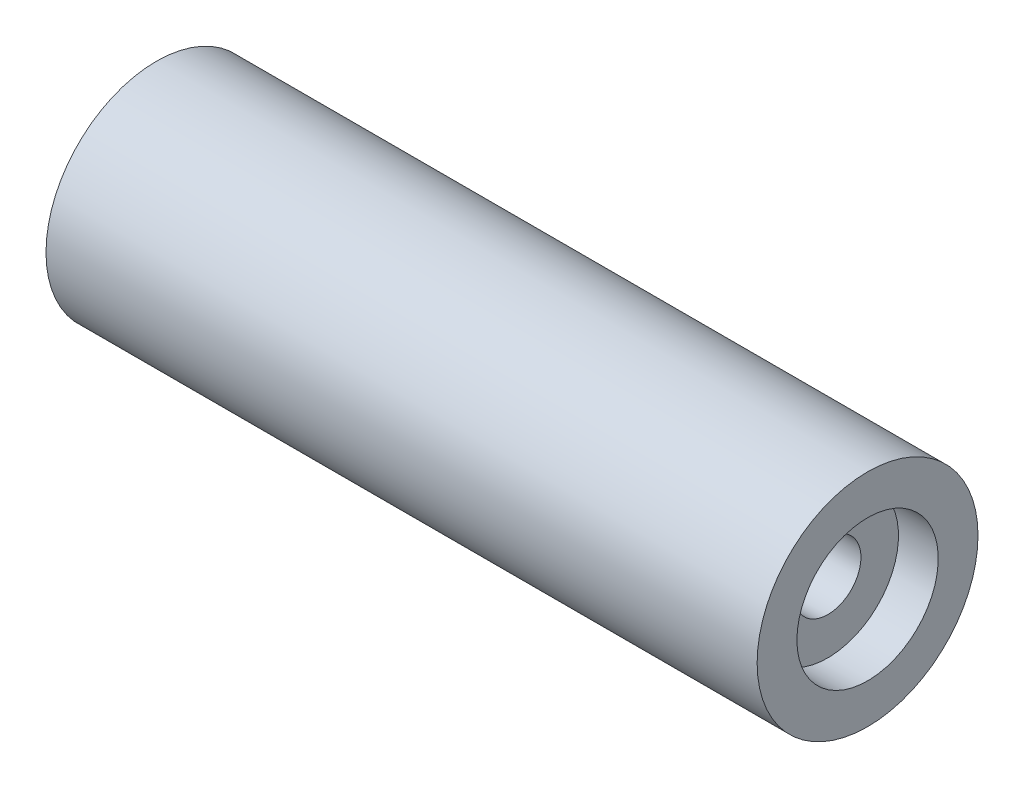
from build123d import *

# Parameters (mm, degrees)
SKETCH1_R           = 25
SKETCH1_R_2         = 7.5
BOSS_EXTRUDE1_DEPTH = 80.5
SKETCH2_R           = 16
CUT_EXTRUDE1_DEPTH  = 9


with BuildPart() as part:
    # Sketch1 → Boss-Extrude1 (new, symmetric)
    with BuildSketch(Plane(origin=(0, 0, 0), x_dir=(0, 0, -1), z_dir=(1, 0, 0))):
        Circle(SKETCH1_R)
        Circle(SKETCH1_R_2, mode=Mode.SUBTRACT)
    extrude(amount=BOSS_EXTRUDE1_DEPTH, both=True)

    # Sketch2 → Cut-Extrude1 (cut)
    with BuildSketch(Plane.ZY.offset(80.5)):
        Circle(SKETCH2_R)
    cut_extrude1 = extrude(amount=-CUT_EXTRUDE1_DEPTH, mode=Mode.SUBTRACT)

    # Mirror1: Cut-Extrude1 across plane
    add(cut_extrude1.mirror(Plane(origin=(0, 0, 0), x_dir=(0, 0, 1), z_dir=(1, 0, 0))), mode=Mode.SUBTRACT)


solid = part.part
